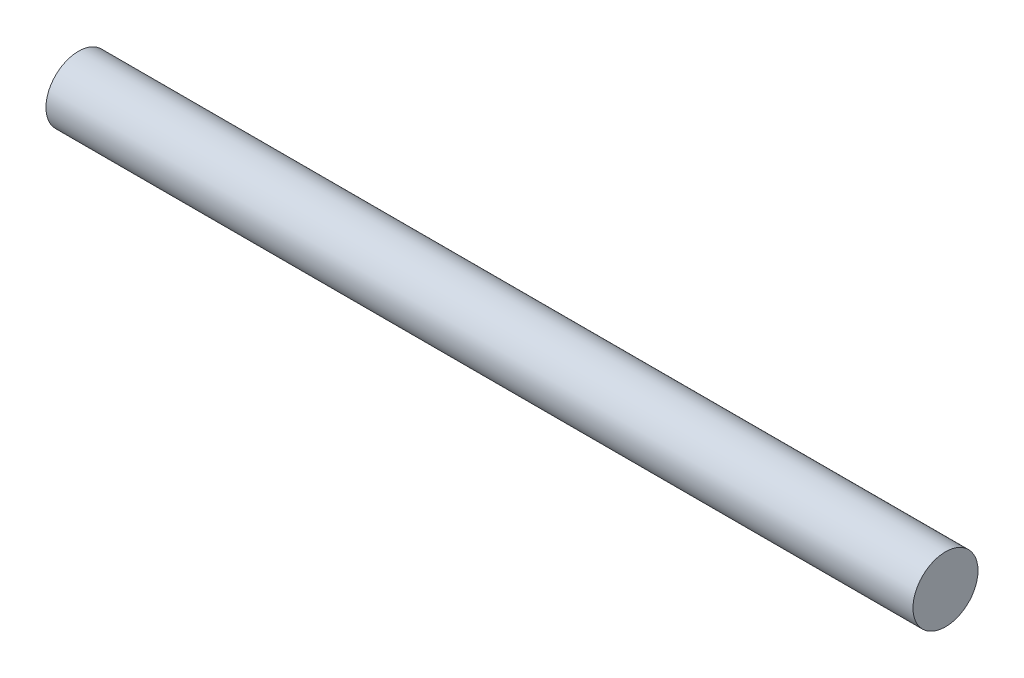
from build123d import *

# Parameters (mm, degrees)
SKETCH1_R           = 0.6
BOSS_EXTRUDE1_DEPTH = 16


with BuildPart() as part:
    # Sketch1 → Boss-Extrude1 (new body)
    with BuildSketch(Plane(origin=(0, 0, 0), x_dir=(0, 0, -1), z_dir=(1, 0, 0))):
        Circle(SKETCH1_R)
    extrude(amount=BOSS_EXTRUDE1_DEPTH)


solid = part.part
